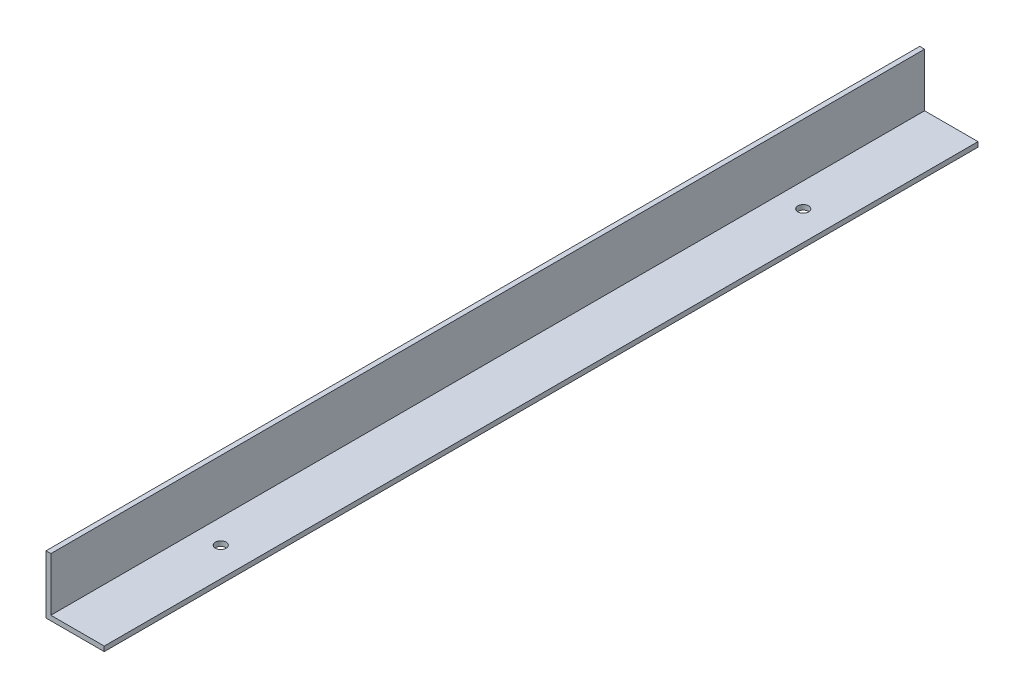
from build123d import *

# Parameters (mm, degrees)
EXTRUDE_1_DEPTH     = 1800
SKETCH_2_R          = 11
CUT_EXTRUDE_1_DEPTH = 1808.982300798


with BuildPart() as part:
    # 草图1 → 凸台-拉伸1 (new body)
    with BuildSketch(Plane.XY):
        Polygon((0, 0), (120, 0), (120, 10), (10, 10), (10, 120), (0, 120), align=None)
    extrude(amount=EXTRUDE_1_DEPTH)

    # 草图2 → 切除-拉伸1 (cut, through all)
    with BuildSketch(Plane(origin=(0, 0, 0), x_dir=(-1, 0, 0), z_dir=(0, -1, 0))):
        with Locations(Location((-60, -1500, 0), (0, 0, 90))):
            Circle(SKETCH_2_R)
        with Locations(Location((-60, -300, 0), (0, 0, 90))):
            Circle(SKETCH_2_R)
    extrude(amount=-CUT_EXTRUDE_1_DEPTH, mode=Mode.SUBTRACT)


solid = part.part
